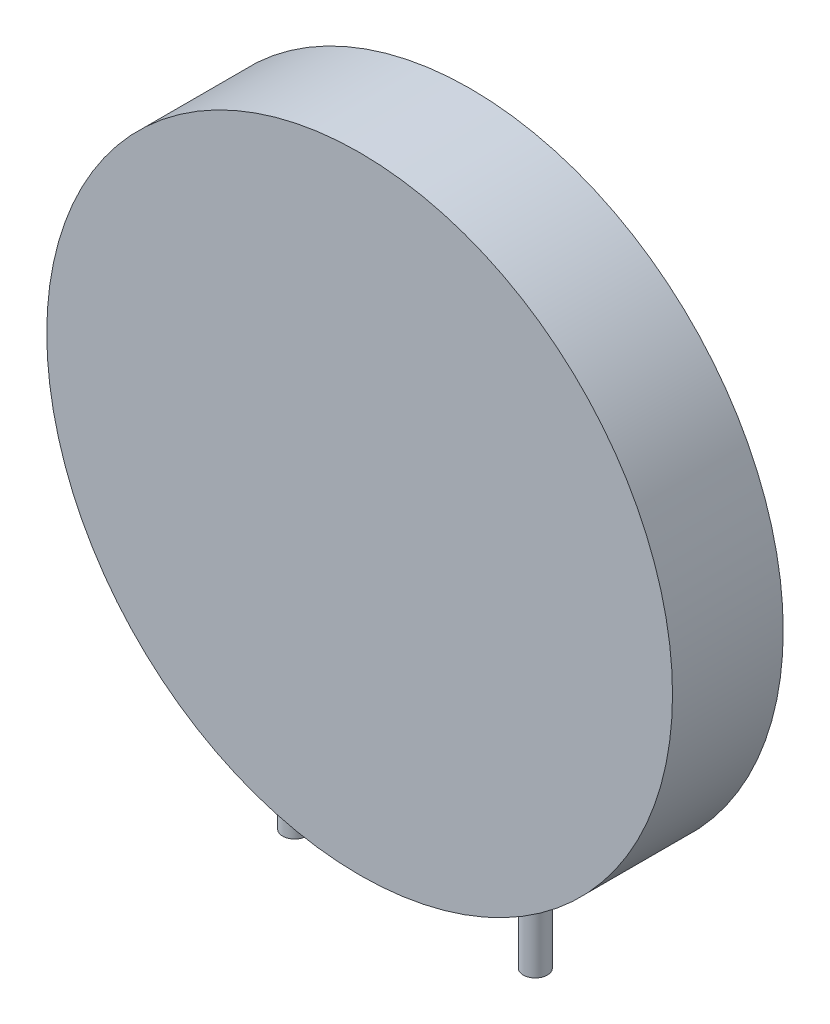
from build123d import *

# Parameters (mm, degrees)
SKETCH1_R           = 13
BOSS_EXTRUDE1_DEPTH = 2.3
SKETCH2_R           = 0.5
BOSS_EXTRUDE2_DEPTH = 15


with BuildPart() as part:
    # Sketch1 → Boss-Extrude1 (new, symmetric)
    with BuildSketch(Plane.XY):
        Circle(SKETCH1_R)
    extrude(amount=BOSS_EXTRUDE1_DEPTH, both=True)

    # Sketch2 → Boss-Extrude2 (add)
    with BuildSketch(Plane(origin=(0, 0, 0), x_dir=(1, 0, 0), z_dir=(0, 1, 0))):
        with Locations(Location((-5, 0, 0), (0, 0, 270))):
            Circle(SKETCH2_R)
        with Locations(Location((5, 0, 0), (0, 0, 270))):
            Circle(SKETCH2_R)
    extrude(amount=-BOSS_EXTRUDE2_DEPTH)


solid = part.part
